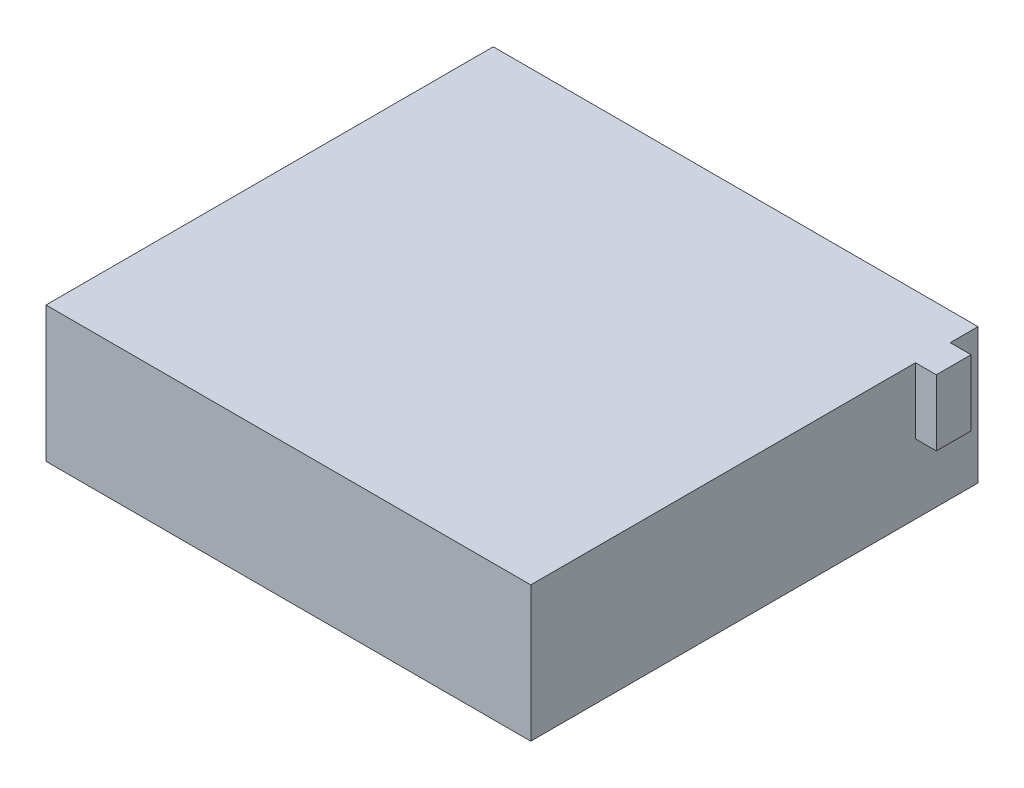
from build123d import *

# Parameters (mm, degrees)
SKETCH1_W           = 69.8
SKETCH1_H           = 64.4
BOSS_EXTRUDE1_DEPTH = 19.5
SKETCH2_W           = 5
SKETCH2_H           = 9.5
BOSS_EXTRUDE2_DEPTH = 3


with BuildPart() as part:
    # Sketch1 → Boss-Extrude1 (new body)
    with BuildSketch(Plane(origin=(0, 0, 0), x_dir=(1, 0, 0), z_dir=(0, 1, 0))):
        Rectangle(SKETCH1_W, SKETCH1_H)
    extrude(amount=BOSS_EXTRUDE1_DEPTH)

    # Sketch2 → Boss-Extrude2 (add)
    with BuildSketch(Plane(origin=(34.9, 0, 0), x_dir=(0, 0, -1), z_dir=(1, 0, 0))):
        with Locations((25.7, 14.75)):
            Rectangle(SKETCH2_W, SKETCH2_H)
    extrude(amount=BOSS_EXTRUDE2_DEPTH)


solid = part.part
